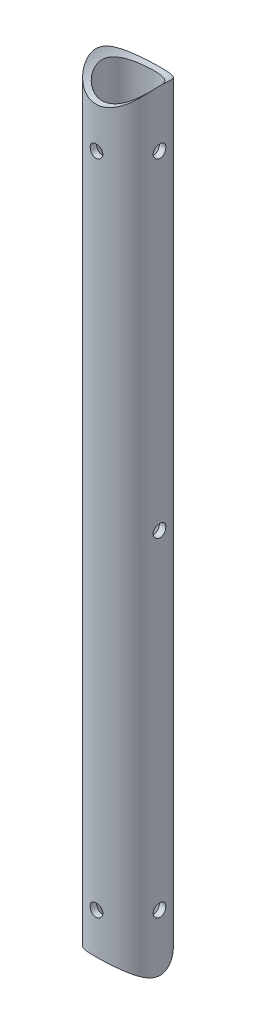
from build123d import *

# Parameters (mm, degrees)
BOSS_EXTRUDE1_DEPTH      = 152.4
BOSS_EXTRUDE1_DEPTH_BACK = 152.4
SKETCH1_R                = 12.7
SKETCH1_R_2              = 10.287
CUT_EXTRUDE1_DEPTH       = 152.4
CUT_EXTRUDE1_DEPTH_BACK  = 152.4
SKETCH2_R                = 15.875
SKETCH2_R_2              = 2.5
CUT_EXTRUDE2_DEPTH       = 50
CUT_EXTRUDE2_DEPTH_BACK  = 50
SKETCH3_R                = 2.5
CUT_EXTRUDE3_DEPTH       = 30
CUT_EXTRUDE3_DEPTH_BACK  = 30
SKETCH4_R                = 2.5


with BuildPart() as part:
    # Sketch1 → Boss-Extrude1 (new, two sides: drawn at the far end of the back side and taken through both)
    with BuildSketch(Plane(origin=(0, 0, 0), x_dir=(1, 0, 0), z_dir=(0, 1, 0)).offset(-BOSS_EXTRUDE1_DEPTH_BACK)):
        Circle(SKETCH1_R)
        Circle(SKETCH1_R_2, mode=Mode.SUBTRACT)
    extrude(amount=BOSS_EXTRUDE1_DEPTH + BOSS_EXTRUDE1_DEPTH_BACK)

    # Sketch2 → Cut-Extrude1 (cut, two sides: drawn at the far end of the back side and taken through both)
    with BuildSketch(Plane.XY.offset(-CUT_EXTRUDE1_DEPTH_BACK)):
        with Locations((0, 161.925)):
            Circle(SKETCH2_R)
        with Locations((0, -161.925)):
            Circle(SKETCH2_R)
        with Locations((0, 130)):
            Circle(SKETCH2_R_2)
        with Locations((0, -130)):
            Circle(SKETCH2_R_2)
    extrude(amount=CUT_EXTRUDE1_DEPTH + CUT_EXTRUDE1_DEPTH_BACK, mode=Mode.SUBTRACT)

    # Sketch3 → Cut-Extrude2 (cut, two sides: drawn at the far end of the back side and taken through both)
    with BuildSketch(Plane(origin=(0, 0, 0), x_dir=(0, 0, -1), z_dir=(1, 0, 0)).offset(-CUT_EXTRUDE2_DEPTH_BACK)):
        with Locations((0, 130)):
            Circle(SKETCH3_R)
        with Locations((0, -130)):
            Circle(SKETCH3_R)
    extrude(amount=CUT_EXTRUDE2_DEPTH + CUT_EXTRUDE2_DEPTH_BACK, mode=Mode.SUBTRACT)

    # Sketch4 → Cut-Extrude3 (cut, two sides: drawn at the far end of the back side and taken through both)
    with BuildSketch(Plane(origin=(0, 0, 0), x_dir=(0, 0, -1), z_dir=(1, 0, 0)).offset(-CUT_EXTRUDE3_DEPTH_BACK)):
        Circle(SKETCH4_R)
    extrude(amount=CUT_EXTRUDE3_DEPTH + CUT_EXTRUDE3_DEPTH_BACK, mode=Mode.SUBTRACT)


solid = part.part
